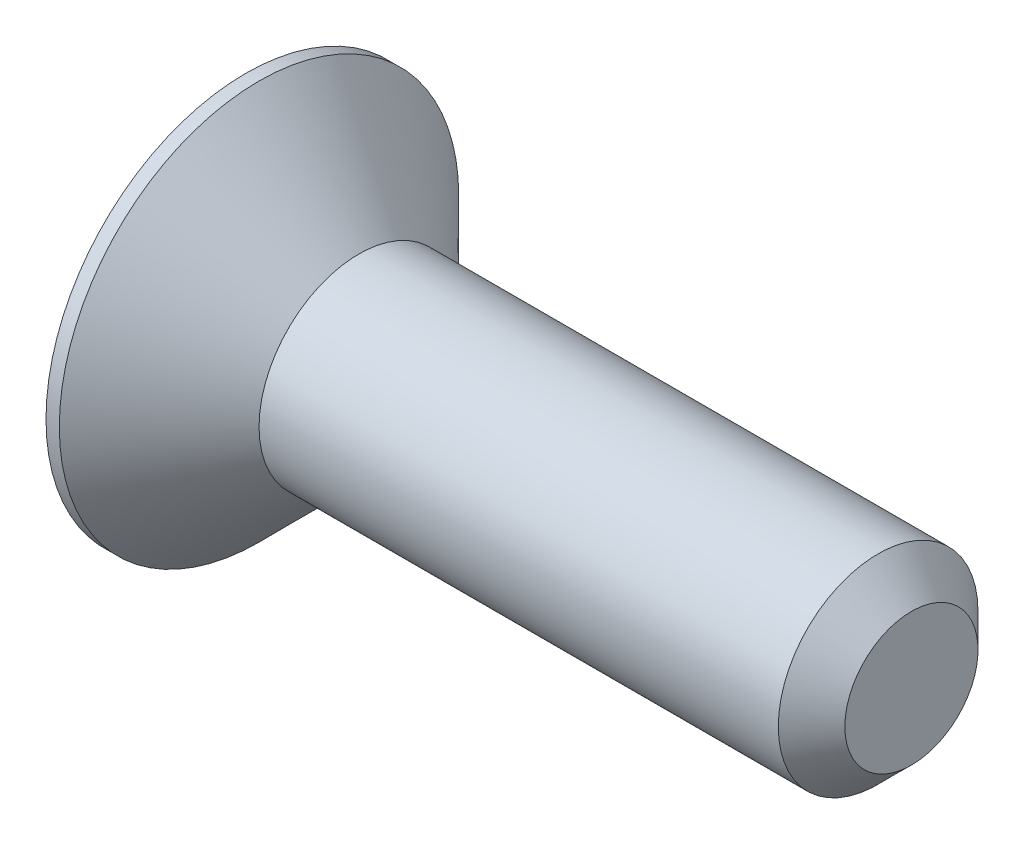
from build123d import *

# Parameters (mm, degrees)
CUT_EXTRUDE1_DEPTH = 1.1


with BuildPart() as part:
    # Sketch1 → Revolve1 (revolve)
    with BuildSketch(Plane.XY, mode=Mode.PRIVATE) as revolve1_sk:
        Polygon((0, -1.5), (7.8, -1.5), (8.3, -1), (8.3, 0), (-1.7, 0), (-1.7, -3), (-1.5, -3), align=None)
    revolve(revolve1_sk.sketch.rotate(Axis((-1.7, 0, 0), (1, 0, 0)), 270), axis=Axis((-1.7, 0, 0), (1, 0, 0)))

    # Sketch2 → Cut-Extrude1 (cut)
    with BuildSketch(Plane.ZY.offset(1.7)):
        Polygon((0, 1.154700538), (-1, 0.577350269), (-1, -0.577350269), (0, -1.154700538), (1, -0.577350269), (1, 0.577350269), align=None)
    extrude(amount=-CUT_EXTRUDE1_DEPTH, mode=Mode.SUBTRACT)


solid = part.part
